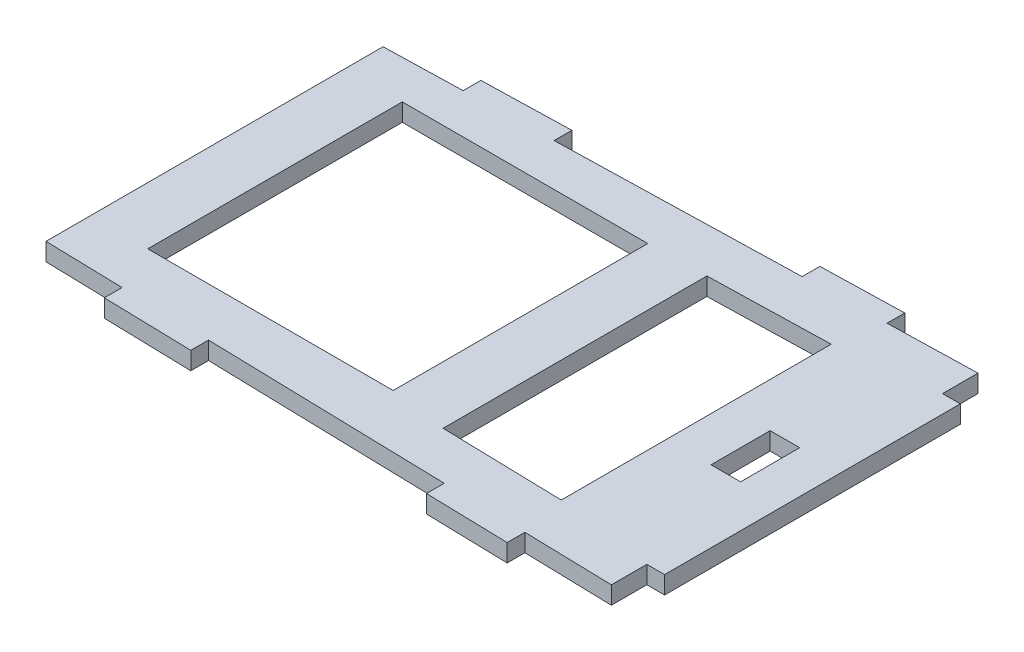
from build123d import *

# Parameters (mm, degrees)
BOSS_EXTRUDE1_DEPTH = 3
SKETCH2_W           = 41.5
SKETCH2_H           = 43.04695539
CUT_EXTRUDE1_DEPTH  = 3


with BuildPart() as part:
    # Sketch1 → Boss-Extrude1 (new body)
    with BuildSketch(Plane(origin=(0, 0, 0), x_dir=(1, 0, 0), z_dir=(0, 1, 0))):
        Polygon((0, -28.5), (0, 28.5), (13.2, 28.836391437), (13.2, 31.837365446), (28.2, 32.219628443), (28.2, 29.218654434), (69.1, 30.260958206), (69.1, 33.261932214), (83.1, 33.618711012), (83.1, 30.617737003), (98.1, 31), (98.1, 25), (101.1, 25), (101.1, -25), (98.1, -25), (98.1, -31), (83.1, -30.617737003), (83.1, -33.618711012), (69.1, -33.261932214), (69.1, -30.260958206), (28.2, -29.218654434), (28.2, -32.219628443), (13.2, -31.837365446), (13.2, -28.836391437), align=None)
    extrude(amount=-BOSS_EXTRUDE1_DEPTH)

    # Sketch2 → Cut-Extrude1 (cut)
    with BuildSketch(Plane.XZ.offset(3)):
        Polygon((60.95, 22.300745789), (60.95, -22.300745789), (81.45, -22.823171885), (81.45, 22.823171885), align=None)
        Polygon((93.95, 0), (93.95, 5), (88.95, 5), (88.95, -5), (93.95, -5), align=None)
        with Locations((30.45, -0.528797146)):
            Rectangle(SKETCH2_W, SKETCH2_H)
    extrude(amount=-CUT_EXTRUDE1_DEPTH, mode=Mode.SUBTRACT)


solid = part.part
